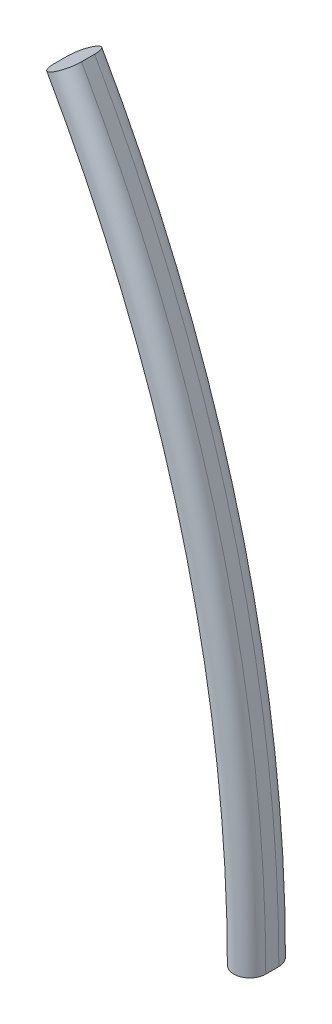
from build123d import *

# Parameters (mm, degrees)
SHELL3_T = -0.4


with BuildPart() as part:
    # Sweep1: sweep along a path in Sketch3
    with BuildLine(Plane.XY) as sweep1_path:
        ThreePointArc((0, 0), (-14.895036805, 114.820168101), (-58.594093346, 222.039222292))
    # Sketch1 → Sweep1 (sweep)
    with BuildSketch(Plane(origin=(0, 0, 0), x_dir=(1, 0, 0), z_dir=(0, 1, 0))):
        with BuildLine():
            Line((-5.125, -2.1), (-5.125, 2.1))
            ThreePointArc((-5.125, 2.1), (0, 7.225), (5.125, 2.1))
            Line((5.125, 2.1), (5.125, -2.1))
            ThreePointArc((5.125, -2.1), (0, -7.225), (-5.125, -2.1))
        make_face()
    sweep(path=sweep1_path.line)

    # Shell3
    shell3_openings = [part.faces().sort_by_distance(p)[0] for p in [
        (0, 0, 0),
    ]]
    offset(amount=SHELL3_T, openings=shell3_openings, kind=Kind.INTERSECTION)


solid = part.part
